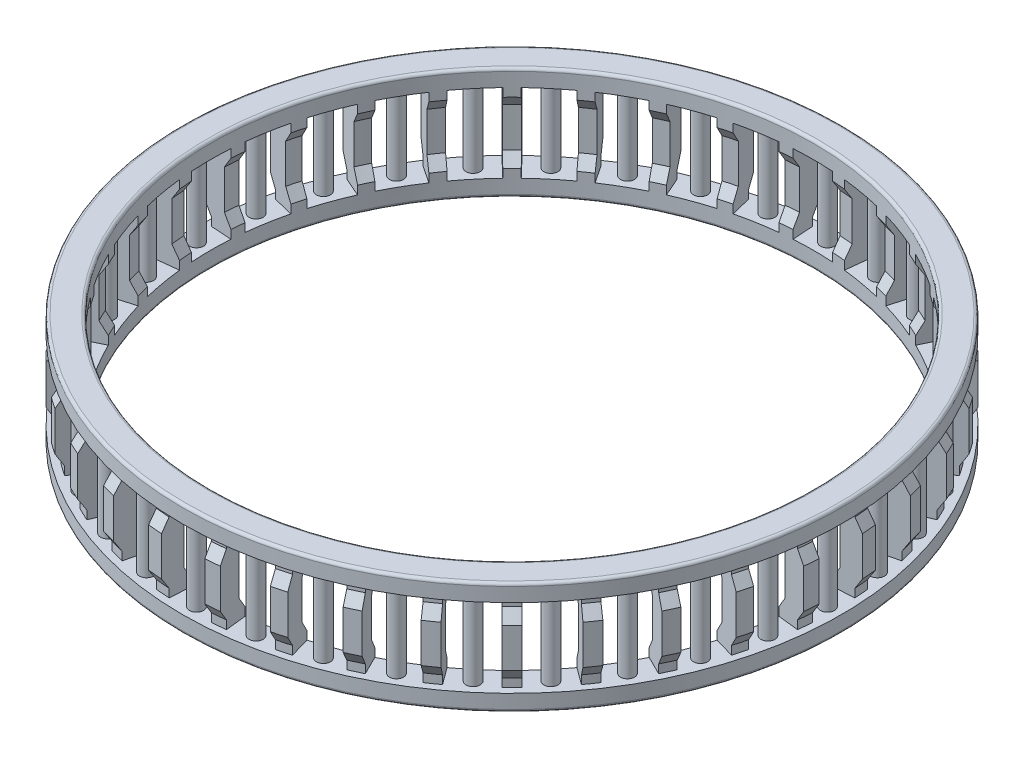
from build123d import *

# Parameters (mm, degrees)
CUT_EXTRUDE1_REACH = 37.383
CUT_EXTRUDE1_START = 1.2
SKETCH2_R          = 0.5
CIRPATTERN3_COUNT  = 36


with BuildPart() as part:
    # Sketch1 → Revolve1 (revolve)
    with BuildSketch(Plane.XY, mode=Mode.PRIVATE) as revolve1_sk:
        with BuildLine():
            Line((-23.5, 2.6), (-23.5, 5.4))
            Line((-23.5, 5.4), (-23, 6.2))
            Line((-23, 6.2), (-23, 6.8))
            Line((-23, 6.8), (-23.5, 6.8))
            Line((-23.5, 6.8), (-23.5, 7.8))
            ThreePointArc((-23.5, 7.8), (-23.441421356, 7.941421356), (-23.3, 8))
            Line((-23.3, 8), (-21.7, 8))
            ThreePointArc((-21.7, 8), (-21.558578644, 7.941421356), (-21.5, 7.8))
            Line((-21.5, 7.8), (-21.5, 6.2))
            Line((-21.5, 6.2), (-22, 5.4))
            Line((-22, 5.4), (-22, 2.6))
            Line((-22, 2.6), (-21.5, 1.8))
            Line((-21.5, 1.8), (-21.5, 0.2))
            ThreePointArc((-21.5, 0.2), (-21.558578644, 0.058578644), (-21.7, 0))
            Line((-21.7, 0), (-23.3, 0))
            ThreePointArc((-23.3, 0), (-23.441421356, 0.058578644), (-23.5, 0.2))
            Line((-23.5, 0.2), (-23.5, 1.2))
            Line((-23.5, 1.2), (-23, 1.2))
            Line((-23, 1.2), (-23, 1.8))
            Line((-23, 1.8), (-23.5, 2.6))
        make_face()
    revolve(revolve1_sk.sketch.rotate(Axis((0, 12.554504505, 0), (0, -1, 0)), 270), axis=Axis((0, 12.554504505, 0), (0, -1, 0)))

    # Cut-Extrude1: up to this face of the body (flat: up to its plane)
    cut_extrude1_end = Plane(part.part.faces().sort_by_distance((0, 6.8, -23.066468037))[0])
    # Sketch2 → Cut-Extrude1 (cut, up to the picked face)
    with BuildSketch(Plane(origin=(0, 0, 0), x_dir=(1, 0, 0), z_dir=(0, 1, 0)).offset(CUT_EXTRUDE1_START), mode=Mode.PRIVATE) as cut_extrude1_sk1:
        Polygon((-23.6, 1.55), (-23.6, -1.55), (-21.3, -1.4), (-21.3, 1.4), align=None)
        with Locations(Location((-22.5, 0, 0), (0, 0, 90))):
            Circle(SKETCH2_R, mode=Mode.SUBTRACT)
    cut_extrude1_tool1 = split(extrude(cut_extrude1_sk1.sketch, amount=CUT_EXTRUDE1_REACH, mode=Mode.PRIVATE), bisect_by=cut_extrude1_end, keep=Keep.BOTH, mode=Mode.PRIVATE)
    cut_extrude1 = cut_extrude1_tool1.solids().sort_by(Axis((-23.561399, 1.2, 0), (0, 1, 0)))[0]
    add(cut_extrude1, mode=Mode.SUBTRACT)

    # CirPattern3: Cut-Extrude1 ×36 about axis
    cirpattern3_axis = Axis((0, 0, 0), (0, 1, 0))
    for i in range(1, CIRPATTERN3_COUNT):
        add(cut_extrude1.rotate(cirpattern3_axis, i * 360 / CIRPATTERN3_COUNT), mode=Mode.SUBTRACT)


solid = part.part
